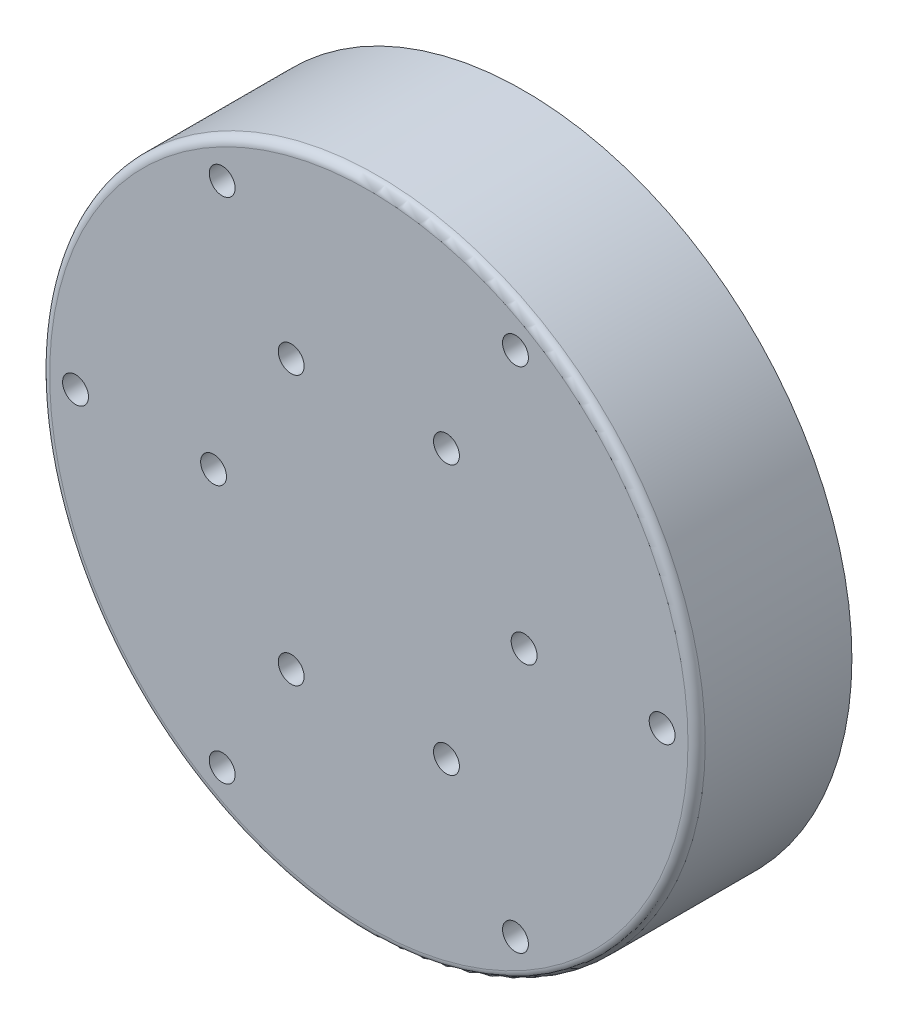
from build123d import *

# Parameters (mm, degrees)
SKETCH_1_R               = 38
EXTRUDE_1_DEPTH          = 18
CUT_EXTRUDE_1_REACH      = 58.675
SKETCH_2_R               = 1.5
CUT_EXTRUDE_2_DEPTH      = 12.5
FILLET_1_R               = 1
CUT_EXTRUDE_7_REACH      = 79.414
CUT_EXTRUDE_7_END_RADIUS = 38
SKETCH_6_W               = 20
SKETCH_6_H               = 4
CUT_EXTRUDE_8_REACH      = 58.675
SKETCH_7_R               = 1.5


with BuildPart() as part:
    # Эскиз1 → Бобышка-Вытянуть1 (new body)
    with BuildSketch(Plane.XY):
        Circle(SKETCH_1_R)
    extrude(amount=EXTRUDE_1_DEPTH)

    # Эскиз2 → Вырез-Вытянуть1 (cut, up to next)
    with BuildSketch(Plane.XY.offset(18), mode=Mode.PRIVATE) as cut_extrude_1_sk1:
        with Locations((-34, 0)):
            Circle(SKETCH_2_R)
    cut_extrude_1_tool1 = extrude(cut_extrude_1_sk1.sketch, amount=-CUT_EXTRUDE_1_REACH, mode=Mode.PRIVATE) & part.part
    # Эскиз2 → Вырез-Вытянуть1 (cut, up to next)
    with BuildSketch(Plane.XY.offset(18), mode=Mode.PRIVATE) as cut_extrude_1_sk2:
        with Locations((-17, 29.444863729)):
            Circle(SKETCH_2_R)
    cut_extrude_1_tool2 = extrude(cut_extrude_1_sk2.sketch, amount=-CUT_EXTRUDE_1_REACH, mode=Mode.PRIVATE) & part.part
    # Эскиз2 → Вырез-Вытянуть1 (cut, up to next)
    with BuildSketch(Plane.XY.offset(18), mode=Mode.PRIVATE) as cut_extrude_1_sk3:
        with Locations((17, 29.444863729)):
            Circle(SKETCH_2_R)
    cut_extrude_1_tool3 = extrude(cut_extrude_1_sk3.sketch, amount=-CUT_EXTRUDE_1_REACH, mode=Mode.PRIVATE) & part.part
    # Эскиз2 → Вырез-Вытянуть1 (cut, up to next)
    with BuildSketch(Plane.XY.offset(18), mode=Mode.PRIVATE) as cut_extrude_1_sk4:
        with Locations((34, 0)):
            Circle(SKETCH_2_R)
    cut_extrude_1_tool4 = extrude(cut_extrude_1_sk4.sketch, amount=-CUT_EXTRUDE_1_REACH, mode=Mode.PRIVATE) & part.part
    # Эскиз2 → Вырез-Вытянуть1 (cut, up to next)
    with BuildSketch(Plane.XY.offset(18), mode=Mode.PRIVATE) as cut_extrude_1_sk5:
        with Locations((17, -29.444863729)):
            Circle(SKETCH_2_R)
    cut_extrude_1_tool5 = extrude(cut_extrude_1_sk5.sketch, amount=-CUT_EXTRUDE_1_REACH, mode=Mode.PRIVATE) & part.part
    # Эскиз2 → Вырез-Вытянуть1 (cut, up to next)
    with BuildSketch(Plane.XY.offset(18), mode=Mode.PRIVATE) as cut_extrude_1_sk6:
        with Locations((-17, -29.444863729)):
            Circle(SKETCH_2_R)
    cut_extrude_1_tool6 = extrude(cut_extrude_1_sk6.sketch, amount=-CUT_EXTRUDE_1_REACH, mode=Mode.PRIVATE) & part.part
    add(cut_extrude_1_tool1.solids().sort_by_distance((-34, 0, 18))[0], mode=Mode.SUBTRACT)
    add(cut_extrude_1_tool2.solids().sort_by_distance((-17, 29.444864, 18))[0], mode=Mode.SUBTRACT)
    add(cut_extrude_1_tool3.solids().sort_by_distance((17, 29.444864, 18))[0], mode=Mode.SUBTRACT)
    add(cut_extrude_1_tool4.solids().sort_by_distance((34, 0, 18))[0], mode=Mode.SUBTRACT)
    add(cut_extrude_1_tool5.solids().sort_by_distance((17, -29.444864, 18))[0], mode=Mode.SUBTRACT)
    add(cut_extrude_1_tool6.solids().sort_by_distance((-17, -29.444864, 18))[0], mode=Mode.SUBTRACT)

    # Эскиз3 → Вырез-Вытянуть2 (cut)
    with BuildSketch(Plane(origin=(0, 0, 0), x_dir=(-1, 0, 0), z_dir=(0, 0, -1))):
        with BuildLine():
            Line((-13.076696831, -27), (13.076696831, -27))
            ThreePointArc((13.076696831, -27), (0, 30), (-13.076696831, -27))
        make_face()
    extrude(amount=-CUT_EXTRUDE_2_DEPTH, mode=Mode.SUBTRACT)

    # Скругление1
    fillet_1_edges = [part.edges().sort_by_distance(p)[0] for p in [
        (-38, 0, 18),
    ]]
    fillet(fillet_1_edges, radius=FILLET_1_R)

    # Вырез-Вытянуть7: up to this cylinder (the profile starts inside it)
    cut_extrude_7_end = Plane(origin=(0, 0, 10.5), z_dir=(0, 0, -1)) * Cylinder(CUT_EXTRUDE_7_END_RADIUS, 235.828, mode=Mode.PRIVATE)
    # Эскиз6 → Вырез-Вытянуть7 (cut, up to the surface)
    with BuildSketch(Plane(origin=(0, -27, 0), x_dir=(1, 0, 0), z_dir=(0, 1, 0)), mode=Mode.PRIVATE) as cut_extrude_7_sk1:
        with Locations((0, -10.5)):
            Rectangle(SKETCH_6_W, SKETCH_6_H)
    cut_extrude_7_tool1 = extrude(cut_extrude_7_sk1.sketch, amount=-CUT_EXTRUDE_7_REACH, mode=Mode.PRIVATE) & cut_extrude_7_end
    add(cut_extrude_7_tool1.solids().sort_by_distance((0, -27, 10.5))[0], mode=Mode.SUBTRACT)

    # Эскиз7 → Вырез-Вытянуть8 (cut, up to next)
    with BuildSketch(Plane.XY.offset(18), mode=Mode.PRIVATE) as cut_extrude_8_sk1:
        with Locations((-18, 0)):
            Circle(SKETCH_7_R)
    cut_extrude_8_tool1 = extrude(cut_extrude_8_sk1.sketch, amount=-CUT_EXTRUDE_8_REACH, mode=Mode.PRIVATE) & part.part
    # Эскиз7 → Вырез-Вытянуть8 (cut, up to next)
    with BuildSketch(Plane.XY.offset(18), mode=Mode.PRIVATE) as cut_extrude_8_sk2:
        with Locations((-9, 15.588457268)):
            Circle(SKETCH_7_R)
    cut_extrude_8_tool2 = extrude(cut_extrude_8_sk2.sketch, amount=-CUT_EXTRUDE_8_REACH, mode=Mode.PRIVATE) & part.part
    # Эскиз7 → Вырез-Вытянуть8 (cut, up to next)
    with BuildSketch(Plane.XY.offset(18), mode=Mode.PRIVATE) as cut_extrude_8_sk3:
        with Locations((9, 15.588457268)):
            Circle(SKETCH_7_R)
    cut_extrude_8_tool3 = extrude(cut_extrude_8_sk3.sketch, amount=-CUT_EXTRUDE_8_REACH, mode=Mode.PRIVATE) & part.part
    # Эскиз7 → Вырез-Вытянуть8 (cut, up to next)
    with BuildSketch(Plane.XY.offset(18), mode=Mode.PRIVATE) as cut_extrude_8_sk4:
        with Locations((18, 0)):
            Circle(SKETCH_7_R)
    cut_extrude_8_tool4 = extrude(cut_extrude_8_sk4.sketch, amount=-CUT_EXTRUDE_8_REACH, mode=Mode.PRIVATE) & part.part
    # Эскиз7 → Вырез-Вытянуть8 (cut, up to next)
    with BuildSketch(Plane.XY.offset(18), mode=Mode.PRIVATE) as cut_extrude_8_sk5:
        with Locations((9, -15.588457268)):
            Circle(SKETCH_7_R)
    cut_extrude_8_tool5 = extrude(cut_extrude_8_sk5.sketch, amount=-CUT_EXTRUDE_8_REACH, mode=Mode.PRIVATE) & part.part
    # Эскиз7 → Вырез-Вытянуть8 (cut, up to next)
    with BuildSketch(Plane.XY.offset(18), mode=Mode.PRIVATE) as cut_extrude_8_sk6:
        with Locations((-9, -15.588457268)):
            Circle(SKETCH_7_R)
    cut_extrude_8_tool6 = extrude(cut_extrude_8_sk6.sketch, amount=-CUT_EXTRUDE_8_REACH, mode=Mode.PRIVATE) & part.part
    add(cut_extrude_8_tool1.solids().sort_by_distance((-18, 0, 18))[0], mode=Mode.SUBTRACT)
    add(cut_extrude_8_tool2.solids().sort_by_distance((-9, 15.588457, 18))[0], mode=Mode.SUBTRACT)
    add(cut_extrude_8_tool3.solids().sort_by_distance((9, 15.588457, 18))[0], mode=Mode.SUBTRACT)
    add(cut_extrude_8_tool4.solids().sort_by_distance((18, 0, 18))[0], mode=Mode.SUBTRACT)
    add(cut_extrude_8_tool5.solids().sort_by_distance((9, -15.588457, 18))[0], mode=Mode.SUBTRACT)
    add(cut_extrude_8_tool6.solids().sort_by_distance((-9, -15.588457, 18))[0], mode=Mode.SUBTRACT)


solid = part.part
